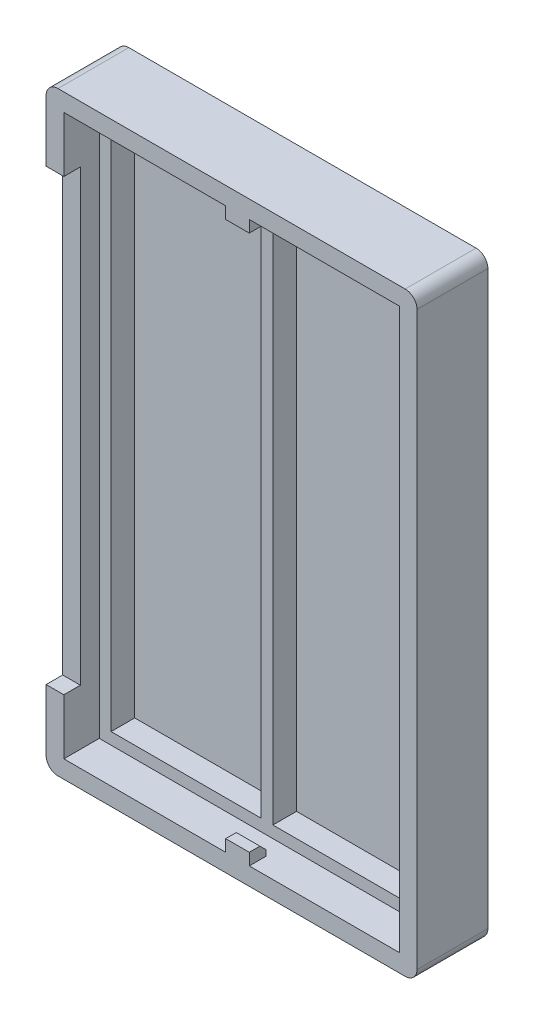
from build123d import *

# Parameters (mm, degrees)
SKETCH1_W           = 47.4
SKETCH1_H           = 28.4
BOSS_EXTRUDE1_DEPTH = 1
SKETCH2_W           = 31.4
SKETCH2_H           = 50.4
SKETCH2_W_2         = 28.4
SKETCH2_H_2         = 47.4
BOSS_EXTRUDE2_DEPTH = 6
SKETCH3_W           = 28.4
SKETCH3_H           = 47.4
SKETCH3_W_2         = 12.7
SKETCH3_H_2         = 45.4
BOSS_EXTRUDE3_DEPTH = 2
SKETCH4_W           = 2
SKETCH4_H           = 1
BOSS_EXTRUDE4_DEPTH = 1.4
CHAMFER1_SIZE       = 0.5
CUT_EXTRUDE1_START  = -1.4
SKETCH5_W           = 9.609138978
SKETCH5_H           = 38
CUT_EXTRUDE1_DEPTH  = 1.4
FILLET1_R           = 1


with BuildPart() as part:
    # Sketch1 → Boss-Extrude1 (new body)
    with BuildSketch(Plane(origin=(0, 0, 0), x_dir=(0, 1, 0), z_dir=(0, 0, 1))):
        Rectangle(SKETCH1_W, SKETCH1_H)
    extrude(amount=BOSS_EXTRUDE1_DEPTH)



with BuildPart() as body_2:
    # Sketch2 → Boss-Extrude2 (new body)
    with BuildSketch(Plane(origin=(0, 0, 0), x_dir=(1, 0, 0), z_dir=(0, 0, -1))):
        Rectangle(SKETCH2_W, SKETCH2_H)
        Rectangle(SKETCH2_W_2, SKETCH2_H_2, mode=Mode.SUBTRACT)
    extrude(amount=-BOSS_EXTRUDE2_DEPTH)


with BuildPart() as part_1:
    add(part.part)

    add(body_2.part)  # Boss-Extrude3 merges body 2
    # Sketch3 → Boss-Extrude3 (add)
    with BuildSketch(Plane.XY.offset(1)):
        Rectangle(SKETCH3_W, SKETCH3_H)
        with Locations((-6.85, 0)):
            Rectangle(SKETCH3_W_2, SKETCH3_H_2, mode=Mode.SUBTRACT)
        with Locations((6.85, 0)):
            Rectangle(SKETCH3_W_2, SKETCH3_H_2, mode=Mode.SUBTRACT)
    extrude(amount=BOSS_EXTRUDE3_DEPTH)

    # Sketch4 → Boss-Extrude4 (add)
    with BuildSketch(Plane.XY.offset(4.6)):
        with Locations((0.5, 23.2)):
            Rectangle(SKETCH4_W, SKETCH4_H)
        with Locations((0.5, -23.2)):
            Rectangle(SKETCH4_W, SKETCH4_H)
    extrude(amount=BOSS_EXTRUDE4_DEPTH)

    # Chamfer1
    chamfer1_edges = [part_1.edges().sort_by_distance(p)[0] for p in [
        (0.5, 22.7, 4.6),
        (0.5, -22.7, 4.6),
    ]]
    chamfer(chamfer1_edges, length=CHAMFER1_SIZE)

    # Sketch5 → Cut-Extrude1 (cut)
    with BuildSketch(Plane.XY.offset(6).offset(CUT_EXTRUDE1_START)):
        with Locations((-14.2, 0)):
            Rectangle(SKETCH5_W, SKETCH5_H)
    extrude(amount=CUT_EXTRUDE1_DEPTH, mode=Mode.SUBTRACT)

    # Fillet1
    fillet1_edges = [part_1.edges().sort_by_distance(p)[0] for p in [
        (-15.7, -25.2, 3),
        (15.7, -25.2, 3),
        (15.7, 25.2, 3),
        (-15.7, 25.2, 3),
    ]]
    fillet(fillet1_edges, radius=FILLET1_R)


solid = part_1.part
